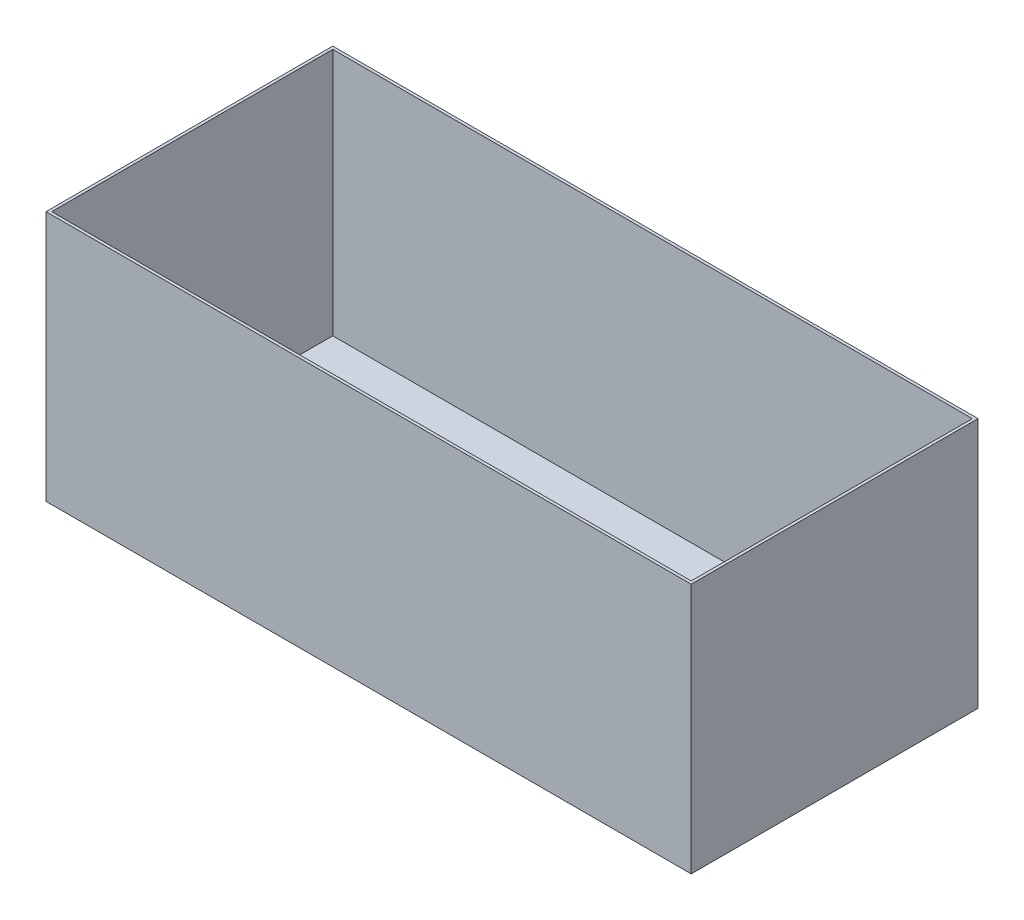
from build123d import *

# Parameters (mm, degrees)
SKETCH1_W           = 228.6
SKETCH1_H           = 101.6
BOSS_EXTRUDE1_DEPTH = 88.9
SHELL1_T            = -1


with BuildPart() as part:
    # Sketch1 → Boss-Extrude1 (new body)
    with BuildSketch(Plane(origin=(0, 0, 0), x_dir=(1, 0, 0), z_dir=(0, 1, 0))):
        with Locations((114.3, 42.307598784)):
            Rectangle(SKETCH1_W, SKETCH1_H)
    extrude(amount=BOSS_EXTRUDE1_DEPTH)

    # Shell1
    shell1_openings = [part.faces().sort_by_distance(p)[0] for p in [
        (114.3, 88.9, -42.307598784),
    ]]
    offset(amount=SHELL1_T, openings=shell1_openings, kind=Kind.INTERSECTION)


solid = part.part
